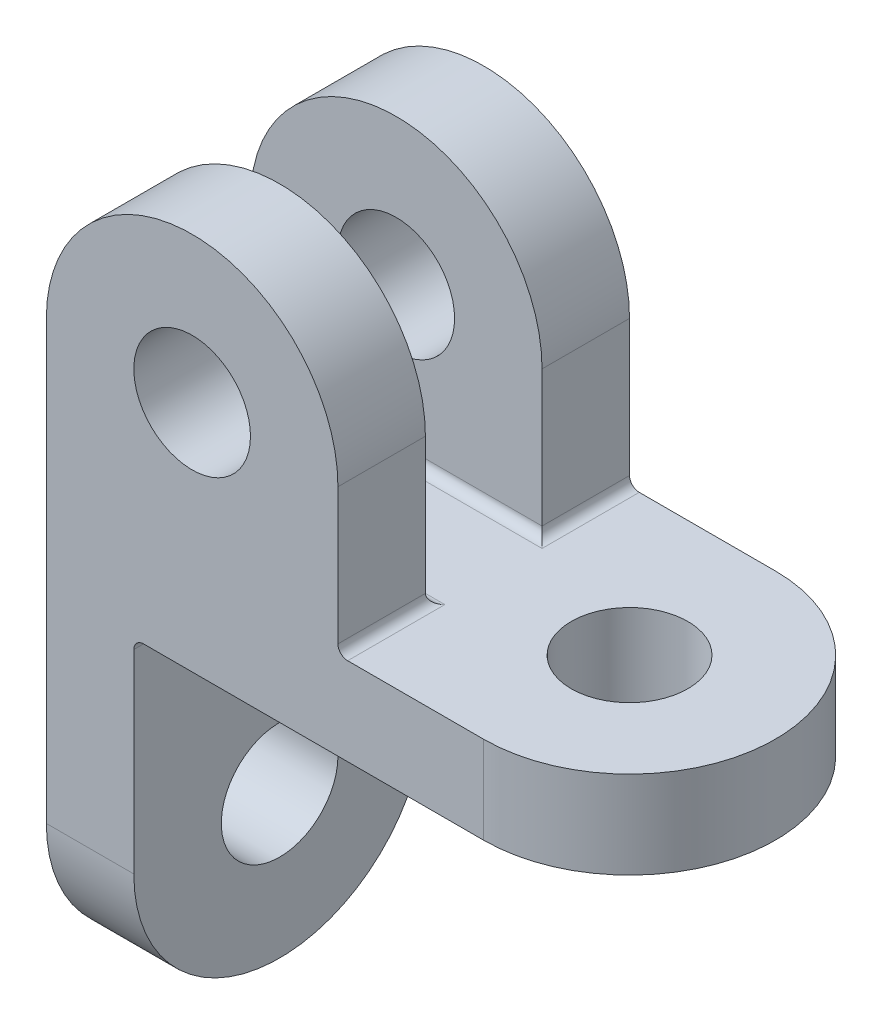
from build123d import *

# Parameters (mm, degrees)
BOSS_EXTRUDE1_DEPTH                  = 15
BOSS_EXTRUDE2_START                  = 6
SKETCH1_3_R                          = 6
BOSS_EXTRUDE2_DEPTH                  = 9
BOSS_EXTRUDE3_START                  = -15
SKETCH1_4_R                          = 6
BOSS_EXTRUDE3_DEPTH                  = 9
FILLET1_RADIUS                       = 15
FILLET1_LENGTH                       = 9
FILLET2_RADIUS                       = 15
FILLET2_LENGTH                       = 9
F_12_0MM_DOWEL_HOLE1_D               = 12
F_12_0MM_DOWEL_HOLE1_DEPTH           = 13
F_12_0MM_DOWEL_HOLE1_ON_FACE_2_D     = 12
F_12_0MM_DOWEL_HOLE1_ON_FACE_2_DEPTH = 13
FILLET6_R                            = 1
FILLET4_R                            = 1
FILLET5_R                            = 1
FILLET7_R                            = 1


with BuildPart() as part:
    # Sketch1 → Boss-Extrude1 (new, symmetric)
    with BuildSketch(Plane.XY):
        Polygon((0, 45), (0, 0), (9, 0), (9, 36), (60, 36), (60, 45), (30, 45), align=None)
    extrude(amount=BOSS_EXTRUDE1_DEPTH, both=True)

    # Sketch1<3> → Boss-Extrude2 (add)
    with BuildSketch(Plane.XY.offset(BOSS_EXTRUDE2_START)):
        with BuildLine():
            Line((0, 60), (0, 45))
            Line((0, 45), (30, 45))
            Line((30, 45), (30, 60))
            ThreePointArc((30, 60), (15, 75), (0, 60))
        make_face()
        with Locations((15, 60)):
            Circle(SKETCH1_3_R, mode=Mode.SUBTRACT)
    extrude(amount=BOSS_EXTRUDE2_DEPTH)

    # Sketch1<4> → Boss-Extrude3 (add)
    with BuildSketch(Plane.XY.offset(BOSS_EXTRUDE3_START)):
        with BuildLine():
            Line((0, 60), (0, 45))
            Line((0, 45), (30, 45))
            Line((30, 45), (30, 60))
            ThreePointArc((30, 60), (15, 75), (0, 60))
        make_face()
        with Locations((15, 60)):
            Circle(SKETCH1_4_R, mode=Mode.SUBTRACT)
    extrude(amount=BOSS_EXTRUDE3_DEPTH)

    # Fillet1: full round fillet: the end face becomes a half cylinder, R = half its width
    fillet1_face = Plane((60, 40.5, 0), x_dir=(0, -1, 0), z_dir=(1, 0, 0))  # on the end face: x along it, z out of the body
    fillet1_slab = fillet1_face.offset(-FILLET1_RADIUS / 2) * Box(FILLET1_LENGTH, 2 * FILLET1_RADIUS, FILLET1_RADIUS, mode=Mode.PRIVATE)  # the body's end, R deep
    fillet1_round = Plane((45, 40.5, 0), x_dir=(1, 0, 0), z_dir=(0, -1, 0)) * Cylinder(FILLET1_RADIUS, FILLET1_LENGTH, mode=Mode.PRIVATE)  # its axis R under the face
    add(fillet1_slab - fillet1_round, mode=Mode.SUBTRACT)

    # Fillet2: full round fillet: the end face becomes a half cylinder, R = half its width
    fillet2_face = Plane((4.5, 0, 0), x_dir=(1, 0, 0), z_dir=(0, -1, 0))  # on the end face: x along it, z out of the body
    fillet2_slab = fillet2_face.offset(-FILLET2_RADIUS / 2) * Box(FILLET2_LENGTH, 2 * FILLET2_RADIUS, FILLET2_RADIUS, mode=Mode.PRIVATE)  # the body's end, R deep
    fillet2_round = Plane((4.5, 15, 0), x_dir=(0, -1, 0), z_dir=(1, 0, 0)) * Cylinder(FILLET2_RADIUS, FILLET2_LENGTH, mode=Mode.PRIVATE)  # its axis R under the face
    add(fillet2_slab - fillet2_round, mode=Mode.SUBTRACT)

    # Ø12.0mm Dowel Hole1
    with Locations(Plane(origin=(45, 45, 0), x_dir=(1, 0, 0), z_dir=(0, 1, 0))):
        with Locations((0, 0)):
            Hole(F_12_0MM_DOWEL_HOLE1_D / 2, depth=F_12_0MM_DOWEL_HOLE1_DEPTH)

    # Ø12.0mm Dowel Hole1 on face 2
    with Locations(Plane(origin=(9, 15, 0), x_dir=(0, 0, 1), z_dir=(1, 0, 0))):
        with Locations((0, 0)):
            Hole(F_12_0MM_DOWEL_HOLE1_ON_FACE_2_D / 2, depth=F_12_0MM_DOWEL_HOLE1_ON_FACE_2_DEPTH)

    # Fillet6
    fillet6_edges = [part.edges().sort_by_distance(p)[0] for p in [
        (9, 36, 0),
    ]]
    fillet(fillet6_edges, radius=FILLET6_R)

    # Fillet4
    fillet4_edges = [part.edges().sort_by_distance(p)[0] for p in [
        (30, 45, -10.5),
    ]]
    fillet(fillet4_edges, radius=FILLET4_R)

    # Fillet5
    fillet5_edges = [part.edges().sort_by_distance(p)[0] for p in [
        (30, 45, 10.5),
    ]]
    fillet(fillet5_edges, radius=FILLET5_R)

    # Fillet7
    fillet7_edges = [part.edges().sort_by_distance(p)[0] for p in [
        (15.5, 45, -6),
        (15.5, 45, 6),
    ]]
    fillet(fillet7_edges, radius=FILLET7_R)


solid = part.part
